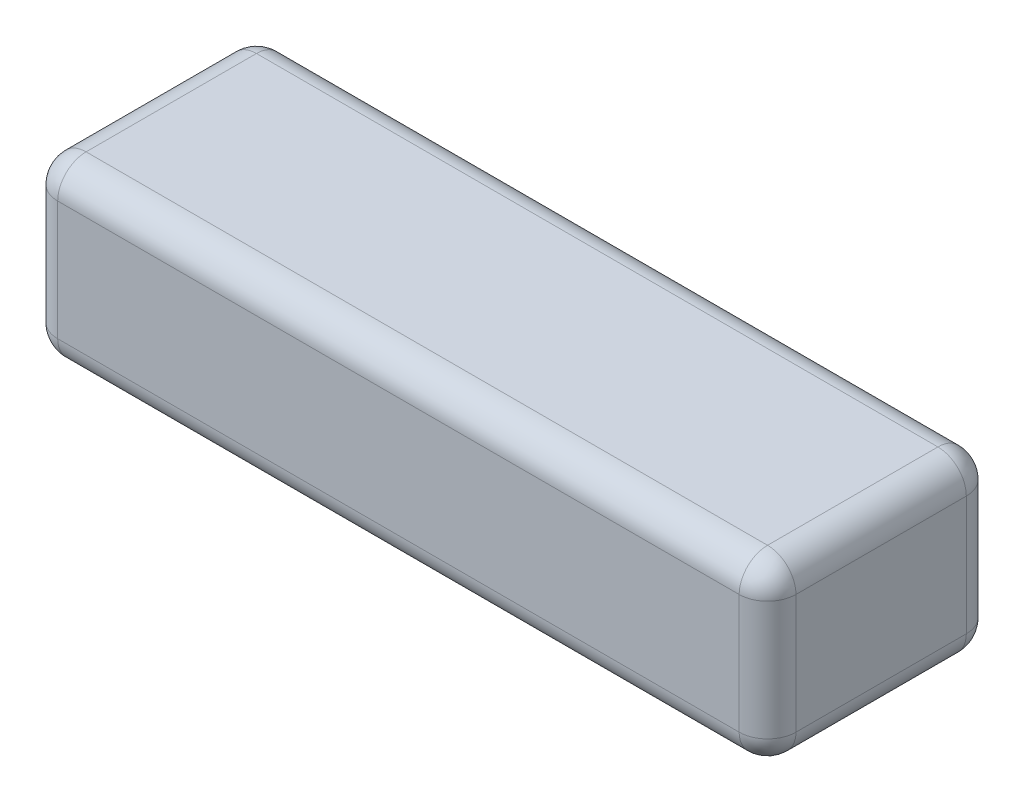
from build123d import *

# Parameters (mm, degrees)
SKETCH1_W           = 130
SKETCH1_H           = 40
BOSS_EXTRUDE1_DEPTH = 31
FILLET1_R           = 5


with BuildPart() as part:
    # Sketch1 → Boss-Extrude1 (new body)
    with BuildSketch(Plane(origin=(0, 0, 0), x_dir=(1, 0, 0), z_dir=(0, 1, 0))):
        with Locations((65, 20)):
            Rectangle(SKETCH1_W, SKETCH1_H)
    extrude(amount=BOSS_EXTRUDE1_DEPTH)

    # Fillet1
    fillet1_edges = [part.edges().sort_by_distance(p)[0] for p in [
        (130, 31, -20),
        (65, 31, -40),
        (0, 31, -20),
        (65, 0, -40),
        (130, 0, -20),
        (65, 0, 0),
        (0, 0, -20),
        (0, 15.5, -40),
        (130, 15.5, -40),
        (130, 15.5, 0),
        (0, 15.5, 0),
        (65, 31, 0),
    ]]
    fillet(fillet1_edges, radius=FILLET1_R)


solid = part.part
